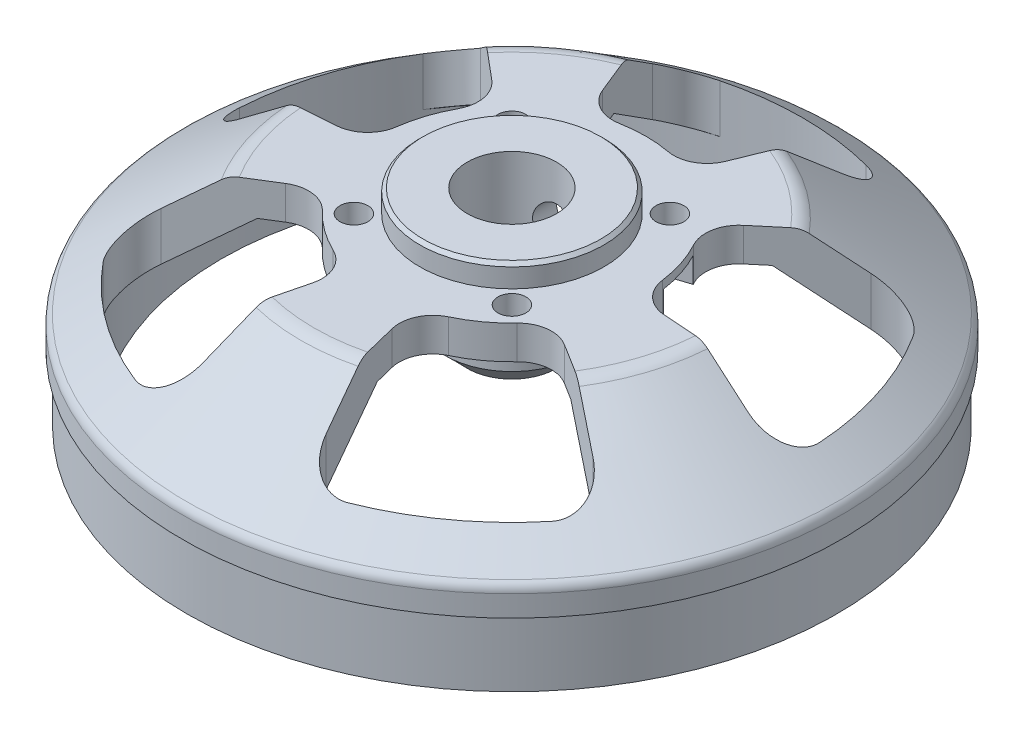
from build123d import *
from build123d.topology import SkipClean

# Parameters (mm, degrees)
SKETCH1_R           = 29.075
SKETCH1_R_2         = 26
BOSS_EXTRUDE1_DEPTH = 6
CUT_EXTRUDE1_DEPTH  = 45.863682417
CIRPATTERN1_COUNT   = 5
SKETCH7_R           = 1.25
CUT_EXTRUDE2_DEPTH  = 45.863682417
SKETCH8_R           = 6
BOSS_EXTRUDE3_DEPTH = 7
CHAMFER2_SIZE       = 2
SKETCH9_R           = 4
CUT_EXTRUDE3_DEPTH  = 44.410828142
CUT_EXTRUDE4_START  = -2.25
CUT_EXTRUDE4_DEPTH  = 2.25
SKETCH11_R          = 1.75
CUT_EXTRUDE5_DEPTH  = 11
CIRPATTERN2_COUNT   = 2
CIRPATTERN2_ANGLE   = 72


with BuildPart() as part:
    # Sketch1 → Boss-Extrude1 (new body)
    with BuildSketch(Plane(origin=(0, 0, 0), x_dir=(1, 0, 0), z_dir=(0, 1, 0))):
        with Locations(Location((0, 0, 0), (0, 0, 270))):
            Circle(SKETCH1_R)
        with Locations(Location((0, 0, 0), (0, 0, 270))):
            Circle(SKETCH1_R_2, mode=Mode.SUBTRACT)
    extrude(amount=-BOSS_EXTRUDE1_DEPTH)

    # Sketch4 → Revolve3 (revolve)
    with BuildSketch(Plane(origin=(0, 0, 0), x_dir=(0, 0, -1), z_dir=(1, 0, 0)), mode=Mode.PRIVATE) as revolve3_sk:
        with BuildLine():
            ThreePointArc((-29.5, 1.890855789), (-29.39114391, 2.344576552), (-29.088274938, 2.699516779))
            Line((-29.088274938, 2.699516779), (-18.89152965, 10.117321981))
            ThreePointArc((-18.89152965, 10.117321981), (-18.333589521, 10.401925861), (-17.714979774, 10.5))
            Line((-17.714979774, 10.5), (-8.25, 10.5))
            Line((-8.25, 10.5), (-8.25, 12.2))
            Line((-8.25, 12.2), (-7.95, 12.5))
            Line((-7.95, 12.5), (-4, 12.5))
            Line((-4, 12.5), (-4, 10.5))
            Line((-4, 10.5), (-4, 7.5))
            Line((-4, 7.5), (-16.539782659, 7.5))
            Line((-16.539782659, 7.5), (-26, 0.617995261))
            Line((-26, 0.617995261), (-26, 0))
            Line((-26, 0), (-29.5, 0))
            Line((-29.5, 0), (-29.5, 1.890855789))
        make_face()
    revolve(revolve3_sk.sketch.rotate(Axis((0, 0, 0), (0, 1, 0)), 180), axis=Axis((0, 0, 0), (0, 1, 0)))

    # Sketch5 → Cut-Extrude1 (cut, through all)
    with BuildSketch(Plane(origin=(0, 10.5, 0), x_dir=(1, 0, 0), z_dir=(0, 1, 0))):
        with BuildLine():
            Line((-5.511351921, 13.624426593), (-8.551315688, 21.139418157))
            ThreePointArc((-8.551315688, 21.139418157), (-8.44981302, 23.613453057), (-6.522881419, 25.168472699))
            ThreePointArc((-6.522881419, 25.168472699), (0, 26), (6.522881419, 25.168472699))
            ThreePointArc((6.522881419, 25.168472699), (8.44981302, 23.613453057), (8.551315688, 21.139418157))
            Line((8.551315688, 21.139418157), (5.511351921, 13.624426593))
            ThreePointArc((5.511351921, 13.624426593), (4.172976008, 12.119099431), (2.184221991, 11.799541275))
            ThreePointArc((2.184221991, 11.799541275), (0, 12), (-2.184221991, 11.799541275))
            ThreePointArc((-2.184221991, 11.799541275), (-4.172976008, 12.119099431), (-5.511351921, 13.624426593))
        make_face()
    cut_extrude1 = extrude(amount=-CUT_EXTRUDE1_DEPTH, mode=Mode.SUBTRACT)

    # CirPattern1: Cut-Extrude1 ×5 about axis
    cirpattern1_axis = Axis((0, 0, 0), (0, 1, 0))
    for i in range(1, CIRPATTERN1_COUNT):
        add(cut_extrude1.rotate(cirpattern1_axis, i * 360 / CIRPATTERN1_COUNT), mode=Mode.SUBTRACT)

    # Sketch7 → Cut-Extrude2 (cut, through all)
    with BuildSketch(Plane(origin=(0, 10.5, 0), x_dir=(1, 0, 0), z_dir=(0, 1, 0))):
        with Locations(Location((7.071067812, 7.071067812, 0), (0, 0, 270))):
            Circle(SKETCH7_R)
        with Locations(Location((7.071067812, -7.071067812, 0), (0, 0, 270))):
            Circle(SKETCH7_R)
        with Locations(Location((-7.071067812, -7.071067812, 0), (0, 0, 270))):
            Circle(SKETCH7_R)
        with Locations(Location((-7.071067812, 7.071067812, 0), (0, 0, 270))):
            Circle(SKETCH7_R)
    extrude(amount=-CUT_EXTRUDE2_DEPTH, mode=Mode.SUBTRACT)

    # Sketch8 → Boss-Extrude3 (add)
    with BuildSketch(Plane(origin=(0, 7.5, 0), x_dir=(-1, 0, 0), z_dir=(0, -1, 0))):
        with Locations(Location((0, 0, 0), (0, 0, 90))):
            Circle(SKETCH8_R)
    extrude(amount=BOSS_EXTRUDE3_DEPTH)

    # Chamfer2
    chamfer2_edges = [part.edges().sort_by_distance(p)[0] for p in [
        (0, 0.5, 6),
    ]]
    chamfer(chamfer2_edges, length=CHAMFER2_SIZE)

    # Sketch9 → Cut-Extrude3 (cut, through all)
    with SkipClean():  # the faces are left unmerged after this step: merging them gives an invalid solid
        with BuildSketch(Plane(origin=(0, 0.5, 0), x_dir=(-1, 0, 0), z_dir=(0, -1, 0))):
            with Locations(Location((0, 0, 0), (0, 0, 90))):
                Circle(SKETCH9_R)
        extrude(amount=-CUT_EXTRUDE3_DEPTH, mode=Mode.SUBTRACT)

    # Sketch10 → Cut-Extrude4 (cut)
    with SkipClean():  # the faces are left unmerged after this step: merging them gives an invalid solid
        with BuildSketch(Plane.XZ.offset(-7.5).offset(CUT_EXTRUDE4_START)):
            with BuildLine():
                ThreePointArc((-2.075, -11.819237497), (0, -12), (2.075, -11.819237497))
                Line((2.075, -11.819237497), (2.075, -8.075))
                Line((2.075, -8.075), (-2.075, -8.075))
                Line((-2.075, -8.075), (-2.075, -11.819237497))
            make_face()
            with BuildLine():
                Line((2.075, -8.075), (-2.075, -8.075))
                ThreePointArc((-2.075, -8.075), (0, -6), (2.075, -8.075))
            make_face()
        cut_extrude4 = extrude(amount=CUT_EXTRUDE4_DEPTH, mode=Mode.SUBTRACT)

    # Sketch11 → Cut-Extrude5 (cut)
    with BuildSketch(Plane(origin=(0, 0, -11.799541275), x_dir=(-1, 0, 0), z_dir=(0, 0, -1))):
        with Locations((0, 7.5)):
            Circle(SKETCH11_R)
    cut_extrude5 = extrude(amount=-CUT_EXTRUDE5_DEPTH, mode=Mode.SUBTRACT)

    # CirPattern2: Cut-Extrude4, Cut-Extrude5 ×2 about axis
    cirpattern2_axis = Axis((0, 0, 0), (0, -1, 0))
    add([cut_extrude4.rotate(cirpattern2_axis, i * CIRPATTERN2_ANGLE / (CIRPATTERN2_COUNT - 1)) for i in range(1, CIRPATTERN2_COUNT)], mode=Mode.SUBTRACT)
    add([cut_extrude5.rotate(cirpattern2_axis, i * CIRPATTERN2_ANGLE / (CIRPATTERN2_COUNT - 1)) for i in range(1, CIRPATTERN2_COUNT)], mode=Mode.SUBTRACT)


solid = part.part
